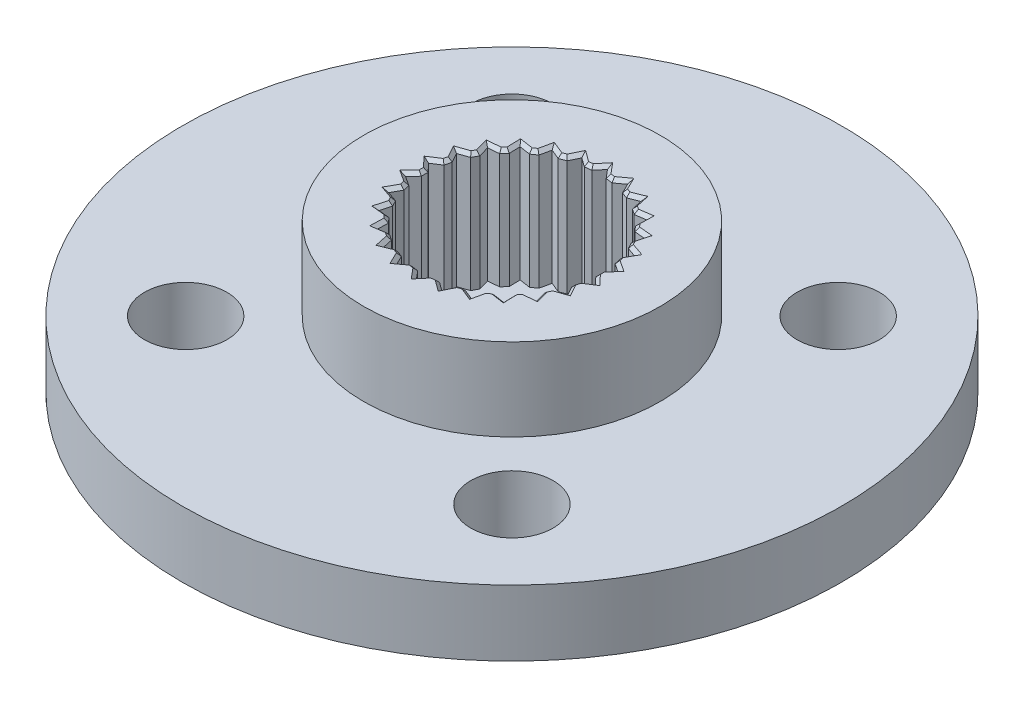
from build123d import *

# Parameters (mm, degrees)
SKETCH1_R           = 10
SKETCH1_R_2         = 1.25
SKETCH1_R_3         = 1.5
BOSS_EXTRUDE1_DEPTH = 2
SKETCH2_R           = 4.5
SKETCH2_R_2         = 1.5
BOSS_EXTRUDE2_DEPTH = 2.5
SKETCH3_R           = 2.25
CUT_EXTRUDE1_DEPTH  = 3.6
CUT_EXTRUDE2_DEPTH  = 3.6
CHAMFER1_SIZE       = 0.1


with BuildPart() as part:
    # Sketch1 → Boss-Extrude1 (new body)
    with BuildSketch(Plane(origin=(0, 0, 0), x_dir=(1, 0, 0), z_dir=(0, 1, 0))):
        with Locations(Location((0, 0, 0), (0, 0, 270))):
            Circle(SKETCH1_R)
        with Locations(Location((-4.949747468, 4.949747468, 0), (0, 0, 270))):
            Circle(SKETCH1_R_2, mode=Mode.SUBTRACT)
        with Locations(Location((4.949747468, 4.949747468, 0), (0, 0, 270))):
            Circle(SKETCH1_R_2, mode=Mode.SUBTRACT)
        with Locations(Location((4.949747468, -4.949747468, 0), (0, 0, 270))):
            Circle(SKETCH1_R_2, mode=Mode.SUBTRACT)
        with Locations(Location((-4.949747468, -4.949747468, 0), (0, 0, 270))):
            Circle(SKETCH1_R_2, mode=Mode.SUBTRACT)
        with Locations(Location((0, 0, 0), (0, 0, 270))):
            Circle(SKETCH1_R_3, mode=Mode.SUBTRACT)
    extrude(amount=BOSS_EXTRUDE1_DEPTH)

    # Sketch2 → Boss-Extrude2 (add)
    with BuildSketch(Plane(origin=(0, 2, 0), x_dir=(1, 0, 0), z_dir=(0, 1, 0))):
        with Locations(Location((0, 0, 0), (0, 0, 270))):
            Circle(SKETCH2_R)
        with Locations(Location((0, 0, 0), (0, 0, 270))):
            Circle(SKETCH2_R_2, mode=Mode.SUBTRACT)
    extrude(amount=BOSS_EXTRUDE2_DEPTH)

    # Sketch3 → Cut-Extrude1 (cut)
    with BuildSketch(Plane(origin=(0, 4.5, 0), x_dir=(1, 0, 0), z_dir=(0, 1, 0))):
        with Locations(Location((0, 0, 0), (0, 0, 270))):
            Circle(SKETCH3_R)
    extrude(amount=-CUT_EXTRUDE1_DEPTH, mode=Mode.SUBTRACT)

    # Sketch7 → Cut-Extrude2 (cut)
    with BuildSketch(Plane(origin=(0, 4.5, 0), x_dir=(1, 0, 0), z_dir=(0, 1, 0))):
        Polygon((-0.842998944, 2.512340101), (-1.034995876, 2.439525269), (-1.129082655, 2.478127827), (-1.347697199, 2.567822474), (-1.398067166, 2.336953865), (-1.419745267, 2.237593211), (-1.588737387, 2.120946373), (-1.689328372, 2.13591077), (-1.923055709, 2.17068117), (-1.916711542, 1.93446686), (-1.913981155, 1.832805537), (-2.050147256, 1.679105783), (-2.151396465, 1.669562343), (-2.386653211, 1.647387766), (-2.32396361, 1.419555673), (-2.296983416, 1.321501868), (-2.392410018, 1.139681668), (-2.488433215, 1.106185022), (-2.711547104, 1.028354172), (-2.59615536, 0.82214507), (-2.54649335, 0.733397313), (-2.595634607, 0.534023397), (-2.680851271, 0.478520248), (-2.878855735, 0.349556373), (-2.717467997, 0.176954384), (-2.648010346, 0.102670372), (-2.648010346, -0.102670372), (-2.717467997, -0.176954384), (-2.878855735, -0.349556373), (-2.680851271, -0.478520248), (-2.595634607, -0.534023397), (-2.54649335, -0.733397313), (-2.59615536, -0.82214507), (-2.711547104, -1.028354172), (-2.488433215, -1.106185022), (-2.392410018, -1.139681668), (-2.296983416, -1.321501868), (-2.32396361, -1.419555673), (-2.386653211, -1.647387766), (-2.151396465, -1.669562343), (-2.050147256, -1.679105783), (-1.913981155, -1.832805537), (-1.916711542, -1.93446686), (-1.923055709, -2.17068117), (-1.689328372, -2.13591077), (-1.588737387, -2.120946373), (-1.419745267, -2.237593211), (-1.398067166, -2.336953865), (-1.347697199, -2.567822474), (-1.129082655, -2.478127827), (-1.034995876, -2.439525269), (-0.842998944, -2.512340101), (-0.798172209, -2.603625605), (-0.694015426, -2.815731271), (-0.503218758, -2.676325101), (-0.421104166, -2.616327824), (-0.217260587, -2.641078915), (-0.151890384, -2.718984089), (0, -2.9), (0.151890384, -2.718984089), (0.217260587, -2.641078915), (0.421104166, -2.616327824), (0.503218758, -2.676325101), (0.694015426, -2.815731271), (0.798172209, -2.603625605), (0.842998944, -2.512340101), (1.034995876, -2.439525269), (1.129082655, -2.478127827), (1.347697199, -2.567822474), (1.398067166, -2.336953865), (1.419745267, -2.237593211), (1.588737387, -2.120946373), (1.689328372, -2.13591077), (1.923055709, -2.17068117), (1.916711542, -1.93446686), (1.913981155, -1.832805537), (2.050147256, -1.679105783), (2.151396465, -1.669562343), (2.386653211, -1.647387766), (2.32396361, -1.419555673), (2.296983416, -1.321501868), (2.392410018, -1.139681668), (2.488433215, -1.106185022), (2.711547104, -1.028354172), (2.59615536, -0.82214507), (2.54649335, -0.733397313), (2.595634607, -0.534023397), (2.680851271, -0.478520248), (2.878855735, -0.349556373), (2.717467997, -0.176954384), (2.648010346, -0.102670372), (2.648010346, 0.102670372), (2.717467997, 0.176954384), (2.878855735, 0.349556373), (2.680851271, 0.478520248), (2.595634607, 0.534023397), (2.54649335, 0.733397313), (2.59615536, 0.82214507), (2.711547104, 1.028354172), (2.488433215, 1.106185022), (2.392410018, 1.139681668), (2.296983416, 1.321501868), (2.32396361, 1.419555673), (2.386653211, 1.647387766), (2.151396465, 1.669562343), (2.050147256, 1.679105783), (1.913981155, 1.832805537), (1.916711542, 1.93446686), (1.923055709, 2.17068117), (1.689328372, 2.13591077), (1.588737387, 2.120946373), (1.419745267, 2.237593211), (1.398067166, 2.336953865), (1.347697199, 2.567822474), (1.129082655, 2.478127827), (1.034995876, 2.439525269), (0.842998944, 2.512340101), (0.798172209, 2.603625605), (0.694015426, 2.815731271), (0.503218758, 2.676325101), (0.421104166, 2.616327824), (0.217260587, 2.641078915), (0.151890384, 2.718984089), (0, 2.9), (-0.151890384, 2.718984089), (-0.217260587, 2.641078915), (-0.421104166, 2.616327824), (-0.503218758, 2.676325101), (-0.694015426, 2.815731271), (-0.798172209, 2.603625605), align=None)
    extrude(amount=-CUT_EXTRUDE2_DEPTH, mode=Mode.SUBTRACT)

    # Chamfer1
    chamfer1_edges = [part.edges().sort_by_distance(p)[0] for p in [
        (-2.218400233, 4.5, 1.663246774),
        (-1.982064206, 4.5, 1.75595566),
        (-1.918518432, 4.5, 2.001743353),
        (-1.755896548, 4.5, 2.145813771),
        (-1.504241327, 4.5, 2.179269792),
        (-1.383721233, 4.5, 2.402707843),
        (-1.191346537, 4.5, 2.503673872),
        (-0.93899741, 4.5, 2.475932685),
        (-0.768507185, 4.5, 2.664035686),
        (-0.557559796, 4.5, 2.716029547),
        (-0.319182376, 4.5, 2.62870337),
        (-0.108630293, 4.5, 2.770539458),
        (0.108630293, 4.5, 2.770539458),
        (0.319182376, 4.5, 2.62870337),
        (0.557559796, 4.5, 2.716029547),
        (0.768507185, 4.5, 2.664035686),
        (0.93899741, 4.5, 2.475932685),
        (1.191346537, 4.5, 2.503673872),
        (1.383721233, 4.5, 2.402707843),
        (1.504241327, 4.5, 2.179269792),
        (1.755896548, 4.5, 2.145813771),
        (1.918518432, 4.5, 2.001743353),
        (1.982064206, 4.5, 1.75595566),
        (2.218400233, 4.5, 1.663246774),
        (2.341818314, 4.5, 1.484444817),
        (2.344696717, 4.5, 1.230591768),
        (2.551978561, 4.5, 1.08401792),
        (2.629020227, 4.5, 0.880875743),
        (2.571063978, 4.5, 0.633710355),
        (2.737245171, 4.5, 0.441789885),
        (2.763433041, 4.5, 0.226113373),
        (2.648010346, 4.5, 0),
        (2.763433041, 4.5, -0.226113373),
        (2.737245171, 4.5, -0.441789885),
        (2.571063978, 4.5, -0.633710355),
        (2.629020227, 4.5, -0.880875743),
        (2.551978561, 4.5, -1.08401792),
        (2.344696717, 4.5, -1.230591768),
        (2.341818314, 4.5, -1.484444817),
        (2.218400233, 4.5, -1.663246774),
        (1.982064206, 4.5, -1.75595566),
        (1.918518432, 4.5, -2.001743353),
        (1.755896548, 4.5, -2.145813771),
        (1.504241327, 4.5, -2.179269792),
        (1.383721233, 4.5, -2.402707843),
        (1.191346537, 4.5, -2.503673872),
        (0.93899741, 4.5, -2.475932685),
        (0.768507185, 4.5, -2.664035686),
        (0.557559796, 4.5, -2.716029547),
        (0.319182376, 4.5, -2.62870337),
        (0.108630293, 4.5, -2.770539458),
        (-0.108630293, 4.5, -2.770539458),
        (-0.319182376, 4.5, -2.62870337),
        (-0.557559796, 4.5, -2.716029547),
        (-0.768507185, 4.5, -2.664035686),
        (-0.93899741, 4.5, -2.475932685),
        (-1.191346537, 4.5, -2.503673872),
        (-1.383721233, 4.5, -2.402707843),
        (-1.504241327, 4.5, -2.179269792),
        (-1.755896548, 4.5, -2.145813771),
        (-1.918518432, 4.5, -2.001743353),
        (-1.982064206, 4.5, -1.75595566),
        (-2.218400233, 4.5, -1.663246774),
        (-2.341818314, 4.5, -1.484444817),
        (-2.344696717, 4.5, -1.230591768),
        (-2.551978561, 4.5, -1.08401792),
        (-2.629020227, 4.5, -0.880875743),
        (-2.571063978, 4.5, -0.633710355),
        (-2.737245171, 4.5, -0.441789885),
        (-2.763433041, 4.5, -0.226113373),
        (-2.648010346, 4.5, 0),
        (-2.763433041, 4.5, 0.226113373),
        (-2.737245171, 4.5, 0.441789885),
        (-2.571063978, 4.5, 0.633710355),
        (-2.629020227, 4.5, 0.880875743),
        (-2.551978561, 4.5, 1.08401792),
        (-2.344696717, 4.5, 1.230591768),
        (-2.341818314, 4.5, 1.484444817),
    ]]
    chamfer(chamfer1_edges, length=CHAMFER1_SIZE)


solid = part.part
